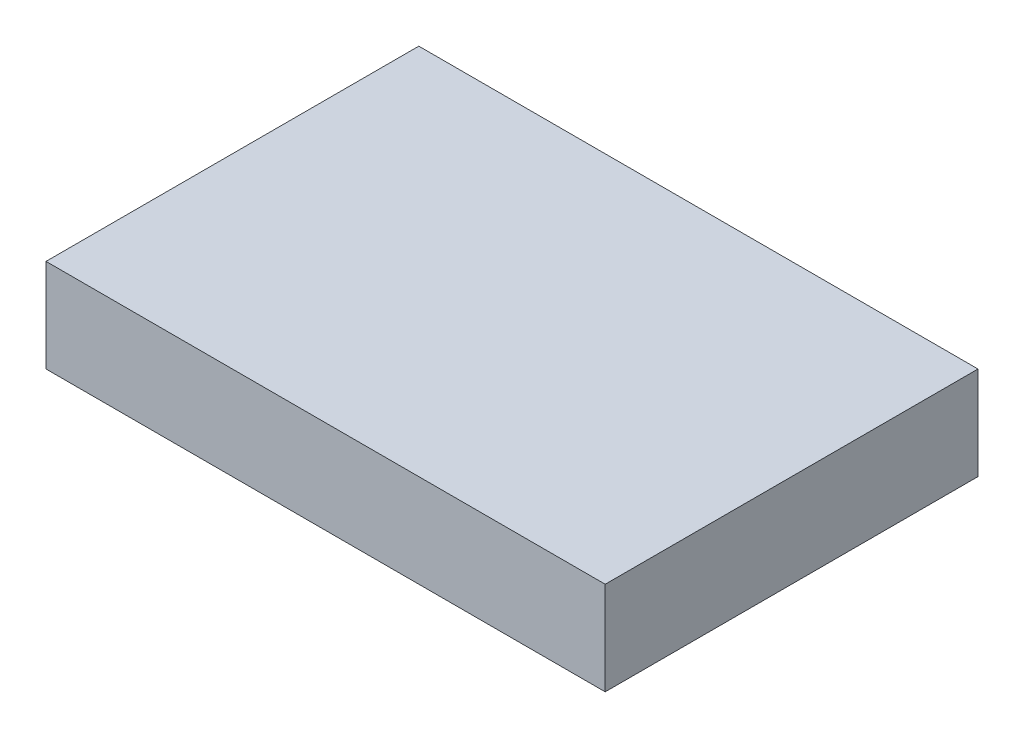
from build123d import *

# Parameters (mm, degrees)
SKETCH1_W           = 30
SKETCH1_H           = 20
BOSS_EXTRUDE1_DEPTH = 5


with BuildPart() as part:
    # Sketch1 → Boss-Extrude1 (new body)
    with BuildSketch(Plane(origin=(0, 0, 0), x_dir=(1, 0, 0), z_dir=(0, 1, 0))):
        Rectangle(SKETCH1_W, SKETCH1_H)
    extrude(amount=BOSS_EXTRUDE1_DEPTH)


solid = part.part
